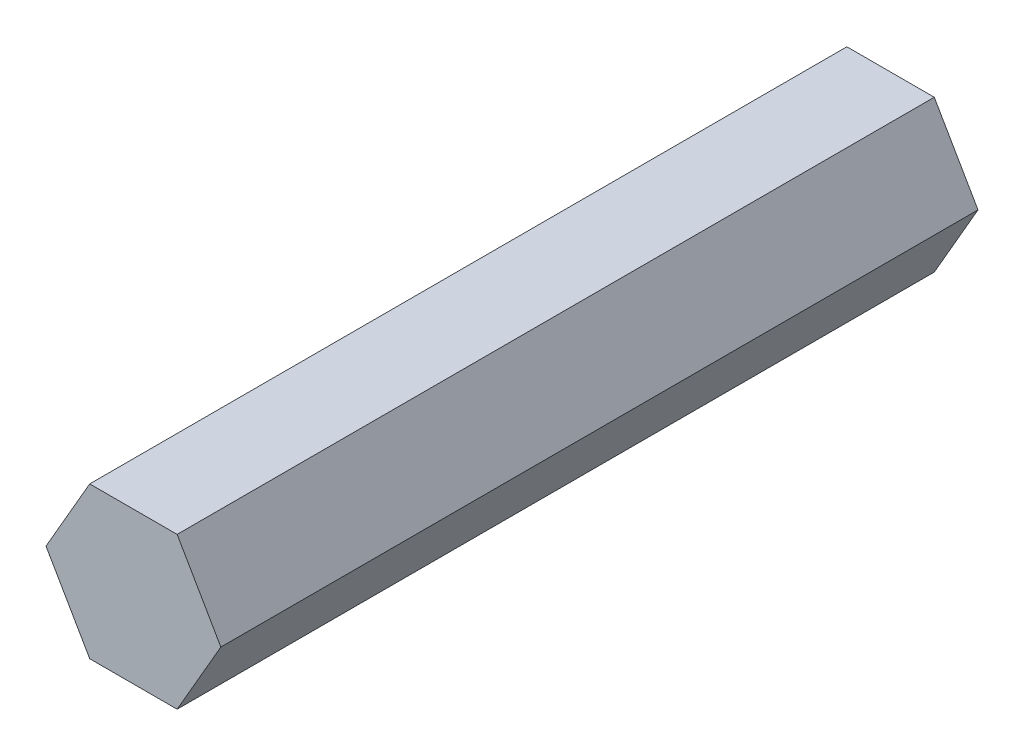
from build123d import *

# Parameters (mm, degrees)
BOSS_EXTRUDE1_DEPTH = 63.5


with BuildPart() as part:
    # Sketch1 → Boss-Extrude1 (new body)
    with BuildSketch(Plane.XY):
        Polygon((7.332348419, 0), (3.666174209, 6.35), (-3.666174209, 6.35), (-7.332348419, 0), (-3.666174209, -6.35), (3.666174209, -6.35), align=None)
    extrude(amount=BOSS_EXTRUDE1_DEPTH)


solid = part.part
